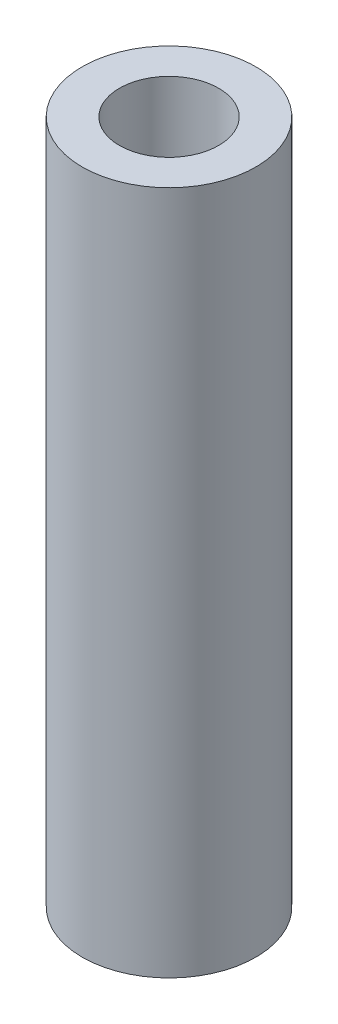
from build123d import *

# Parameters (mm, degrees)
SKETCH1_R           = 3.5
SKETCH1_R_2         = 2
BOSS_EXTRUDE1_DEPTH = 27.58


with BuildPart() as part:
    # Sketch1 → Boss-Extrude1 (new body)
    with BuildSketch(Plane(origin=(0, 0, 0), x_dir=(1, 0, 0), z_dir=(0, 1, 0))):
        with Locations(Location((0, 0, 0), (0, 0, 270))):
            Circle(SKETCH1_R)
        with Locations(Location((0, 0, 0), (0, 0, 270))):
            Circle(SKETCH1_R_2, mode=Mode.SUBTRACT)
    extrude(amount=BOSS_EXTRUDE1_DEPTH)


solid = part.part
